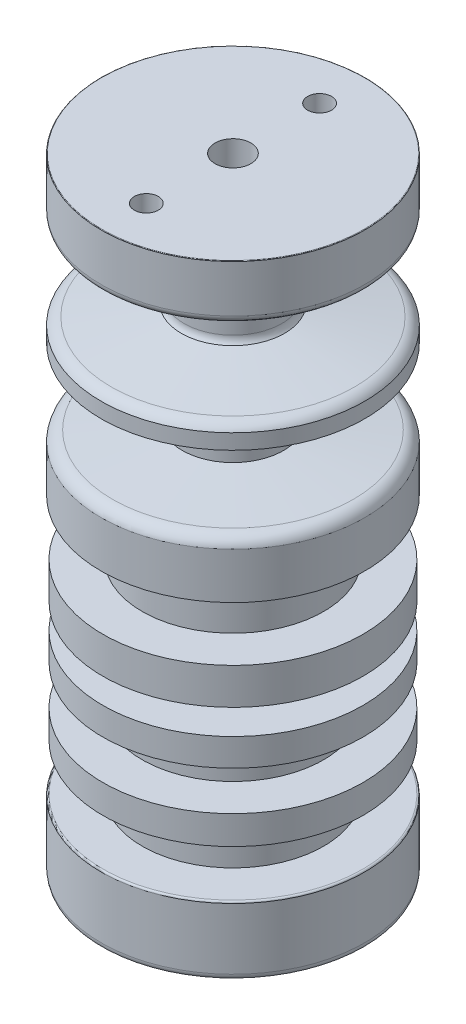
from build123d import *

# Parameters (mm, degrees)
CROQUIS2_R            = 3.175
CORTAR_EXTRUIR2_DEPTH = 12
CROQUIS6_R            = 4.7625
CORTAR_EXTRUIR4_DEPTH = 12
CROQUIS11_R           = 7.9375
CORTAR_EXTRUIR7_DEPTH = 15.875


with BuildPart() as part:
    # Croquis1 → Revolución3 (revolve)
    with BuildSketch(Plane.XY, mode=Mode.PRIVATE) as revoluci_n3_sk:
        with BuildLine():
            Line((0, 43.044568245), (34.858419682, 43.044568245))
            ThreePointArc((34.858419682, 43.044568245), (34.958532085, 43.00310033), (35, 42.902987927))
            Line((35, 42.902987927), (35, 30.36601493))
            ThreePointArc((35, 30.36601493), (34.403772828, 28.926595206), (32.964353105, 28.330368034))
            Line((32.964353105, 28.330368034), (12.985796912, 28.330368034))
            Line((12.985796912, 28.330368034), (12.985796912, 10.406207601))
            ThreePointArc((12.985796912, 10.406207601), (13.175212613, 9.391052882), (13.717969076, 8.512512712))
            Line((13.717969076, 8.512512712), (32.309744815, 5.485961945))
            ThreePointArc((32.309744815, 5.485961945), (33.884795273, 4.831882369), (35, 3.541563627))
            Line((35, 3.541563627), (35, -0.490098714))
            Line((35, -0.490098714), (13.468735488, -0.490098714))
            Line((13.468735488, -0.490098714), (13.468735488, -18.538757946))
            Line((13.468735488, -18.538757946), (31.979226627, -20.513196287))
            ThreePointArc((31.979226627, -20.513196287), (33.927671218, -21.380602851), (35, -23.224224681))
            Line((35, -23.224224681), (35, -35.501069654))
            Line((35, -35.501069654), (24.086053365, -35.501069654))
            Line((24.086053365, -35.501069654), (24.086053365, -50.263273296))
            Line((24.086053365, -50.263273296), (34.538342083, -50.263273296))
            Line((34.538342083, -50.263273296), (34.538342083, -59.917933312))
            Line((34.538342083, -59.917933312), (24.086053365, -59.917933312))
            Line((24.086053365, -59.917933312), (24.086053365, -66.61708516))
            Line((24.086053365, -66.61708516), (34.538342083, -66.61708516))
            Line((34.538342083, -66.61708516), (34.538342083, -73.907338641))
            Line((34.538342083, -73.907338641), (24.086053365, -73.907338641))
            Line((24.086053365, -73.907338641), (24.086053365, -84.350134169))
            Line((24.086053365, -84.350134169), (34.538342083, -84.350134169))
            Line((34.538342083, -84.350134169), (34.538342083, -91.92338166))
            Line((34.538342083, -91.92338166), (24.086053365, -91.92338166))
            Line((24.086053365, -91.92338166), (24.086053365, -104.221668074))
            Line((24.086053365, -104.221668074), (34.538342083, -104.221668074))
            ThreePointArc((34.538342083, -104.221668074), (34.864783527, -104.356884547), (35, -104.683325991))
            Line((35, -104.683325991), (35, -120.950877143))
            ThreePointArc((35, -120.950877143), (34.933442046, -121.487214162), (34.737806004, -121.991013624))
            Line((34.737806004, -121.991013624), (0, -121.955431755))
            Line((0, -121.955431755), (0, 43.044568245))
        make_face()
    revolve(revoluci_n3_sk.sketch.rotate(Axis((0, 43.044568245, 0), (0, -1, 0)), 180), axis=Axis((0, 43.044568245, 0), (0, -1, 0)))

    # Croquis2 → Cortar-Extruir2 (cut)
    with BuildSketch(Plane(origin=(0, 43.044568245, 0), x_dir=(1, 0, 0), z_dir=(0, 1, 0))):
        with Locations(Location((0, 23, 0), (0, 0, 270))):
            Circle(CROQUIS2_R)
        with Locations(Location((0, -23, 0), (0, 0, 270))):
            Circle(CROQUIS2_R)
    extrude(amount=-CORTAR_EXTRUIR2_DEPTH, mode=Mode.SUBTRACT)

    # Croquis6 → Cortar-Extruir4 (cut)
    with BuildSketch(Plane(origin=(0, 43.044568245, 0), x_dir=(1, 0, 0), z_dir=(0, 1, 0))):
        with Locations(Location((0, 0, 0), (0, 0, 270))):
            Circle(CROQUIS6_R)
    extrude(amount=-CORTAR_EXTRUIR4_DEPTH, mode=Mode.SUBTRACT)

    # Croquis11 → Cortar-Extruir7 (cut)
    with BuildSketch(Plane(origin=(0, -126.955431755, 0), x_dir=(1, 0, 0), z_dir=(0, 1, 0))):
        Circle(CROQUIS11_R)
    extrude(amount=CORTAR_EXTRUIR7_DEPTH, mode=Mode.SUBTRACT)


solid = part.part
